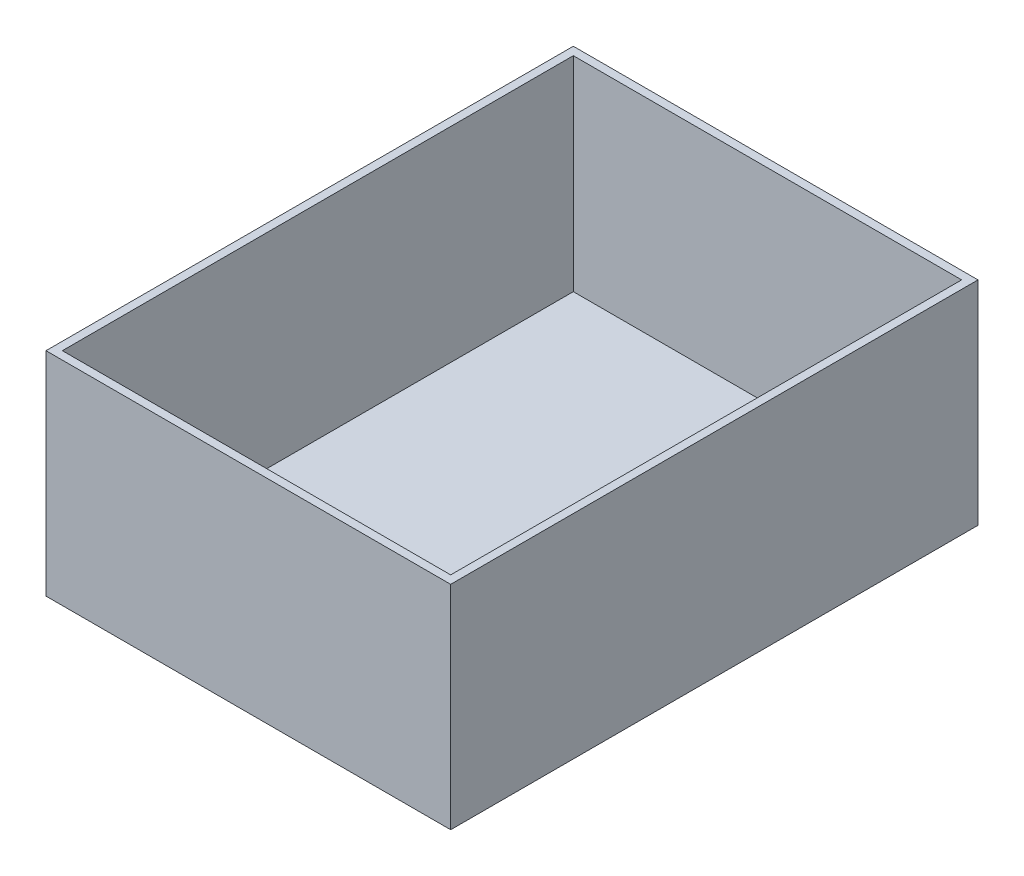
from build123d import *

# Parameters (mm, degrees)
SKETCH2_W   = 99
SKETCH2_H   = 129
SKETCH2_W_2 = 95
SKETCH2_H_2 = 125
WALLS_DEPTH = 50
SKETCH3_W   = 99
SKETCH3_H   = 129
BASE_DEPTH  = 2


with BuildPart() as part:
    # Sketch2 → Walls (new body)
    with BuildSketch(Plane(origin=(0, 0, 0), x_dir=(1, 0, 0), z_dir=(0, 1, 0))):
        Rectangle(SKETCH2_W, SKETCH2_H)
        Rectangle(SKETCH2_W_2, SKETCH2_H_2, mode=Mode.SUBTRACT)
    extrude(amount=WALLS_DEPTH)

    # Sketch3 → Base (add)
    with BuildSketch(Plane.XZ):
        Rectangle(SKETCH3_W, SKETCH3_H)
    extrude(amount=BASE_DEPTH)


solid = part.part
